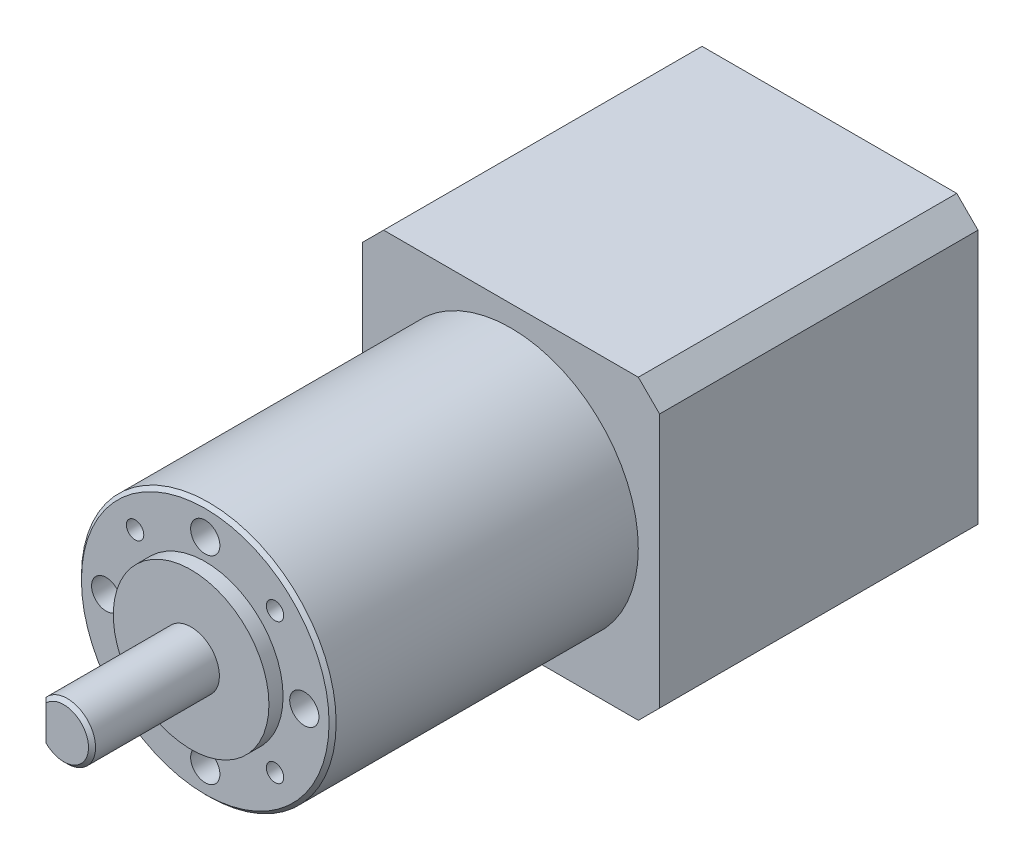
from build123d import *

# Parameters (mm, degrees)
SKETCH1_W                  = 42
SKETCH1_H                  = 45
BOSS_EXTRUDE1_DEPTH        = 42
SKETCH2_R                  = 18
BOSS_EXTRUDE2_DEPTH        = 43.2
SKETCH3_R                  = 11
BOSS_EXTRUDE3_DEPTH        = 2
SKETCH4_R                  = 4
BOSS_EXTRUDE4_DEPTH        = 18
CUT_EXTRUDE1_START         = -15
CUT_EXTRUDE1_DEPTH         = 15
M2_CLEARANCE_HOLE1_D       = 2.459
M2_CLEARANCE_HOLE1_DEPTH   = 4
M3_5_CLEARANCE_HOLE1_D     = 4.134
M3_5_CLEARANCE_HOLE1_DEPTH = 5
CHAMFER1_SIZE              = 3
CHAMFER2_SIZE              = 0.5


with BuildPart() as part:
    # Sketch1 → Boss-Extrude1 (new body)
    with BuildSketch(Plane(origin=(0, 42, 0), x_dir=(1, 0, 0), z_dir=(0, 1, 0))):
        with Locations((21, -22.5)):
            Rectangle(SKETCH1_W, SKETCH1_H)
    extrude(amount=-BOSS_EXTRUDE1_DEPTH)

    # Sketch2 → Boss-Extrude2 (add)
    with BuildSketch(Plane.XY.offset(45)):
        with Locations(Location((20.992732048, 21.029062271, 0), (0, 0, 180))):
            Circle(SKETCH2_R)
    extrude(amount=BOSS_EXTRUDE2_DEPTH)

    # Sketch3 → Boss-Extrude3 (add)
    with BuildSketch(Plane.XY.offset(88.2)):
        with Locations((20.992732048, 21.029062271)):
            Circle(SKETCH3_R)
    extrude(amount=BOSS_EXTRUDE3_DEPTH)

    # Sketch4 → Boss-Extrude4 (add)
    with BuildSketch(Plane.XY.offset(90.2)):
        with Locations((20.992732048, 21.029062271)):
            Circle(SKETCH4_R)
    extrude(amount=BOSS_EXTRUDE4_DEPTH)

    # Sketch5 → Cut-Extrude1 (cut)
    with BuildSketch(Plane.XY.offset(108.2).offset(CUT_EXTRUDE1_START)):
        with BuildLine():
            Line((17.987520214, 18.389232384), (18.004545147, 23.688148401))
            ThreePointArc((18.004545147, 23.688148401), (16.992752693, 21.041913839), (17.987520214, 18.389232384))
        make_face()
    extrude(amount=CUT_EXTRUDE1_DEPTH, mode=Mode.SUBTRACT)

    # M2 Clearance Hole1
    with Locations(Plane.XY.offset(88.2)):
        with Locations((11.075764894, 30.962638855), (30.85750103, 30.962638855), (11.075764894, 11.143120527), (30.85750103, 11.143120527)):
            Hole(M2_CLEARANCE_HOLE1_D / 2, depth=M2_CLEARANCE_HOLE1_DEPTH)

    # M3.5 Clearance Hole1
    with Locations(Plane.XY.offset(88.2)):
        with Locations((6.992732048, 21.029062271), (34.992732048, 21.029062271), (20.992732048, 7.029062271), (20.992732048, 35.029062271)):
            Hole(M3_5_CLEARANCE_HOLE1_D / 2, depth=M3_5_CLEARANCE_HOLE1_DEPTH)

    # Chamfer1
    chamfer1_edges = [part.edges().sort_by_distance(p)[0] for p in [
        (0, 0, 22.5),
        (42, 0, 22.5),
        (0, 42, 22.5),
        (42, 42, 22.5),
    ]]
    chamfer(chamfer1_edges, length=CHAMFER1_SIZE)

    # Chamfer2
    chamfer2_edges = [part.edges().sort_by_distance(p)[0] for p in [
        (38.992732048, 21.029062271, 88.2),
        (22.403255473, 17.286012222, 108.2),
        (17.996032681, 21.038690392, 108.2),
    ]]
    chamfer(chamfer2_edges, length=CHAMFER2_SIZE)


solid = part.part
